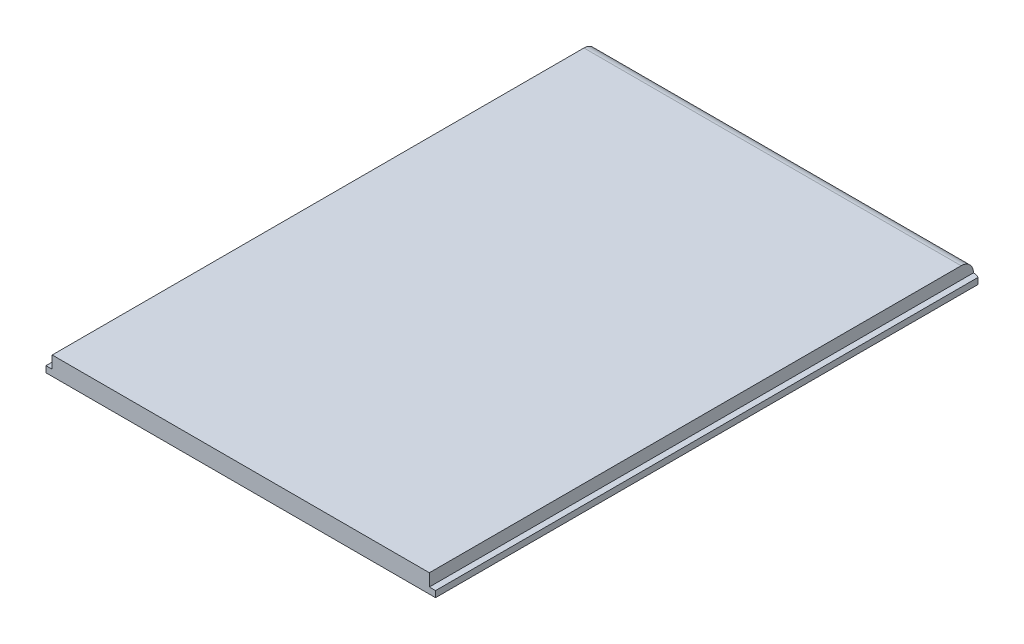
from build123d import *

# Parameters (mm, degrees)
SKETCH2_W           = 77.47
SKETCH2_H           = 111.76
BOSS_EXTRUDE1_DEPTH = 3.81
SKETCH3_W           = 1.27
SKETCH3_H           = 1.27
BOSS_EXTRUDE2_DEPTH = 111.76
FILLET1_R           = 2.54
CUT_EXTRUDE1_REACH  = 70.829


with BuildPart() as part:
    # Sketch2 → Boss-Extrude1 (new body)
    with BuildSketch(Plane(origin=(0, 0, 0), x_dir=(1, 0, 0), z_dir=(0, 1, 0))):
        Rectangle(SKETCH2_W, SKETCH2_H)
    extrude(amount=BOSS_EXTRUDE1_DEPTH)

    # Sketch3 → Boss-Extrude2 (add)
    with BuildSketch(Plane.XY.offset(55.88)):
        with Locations((-39.37, 0.635)):
            Rectangle(SKETCH3_W, SKETCH3_H)
        with Locations((39.37, 0.635)):
            Rectangle(SKETCH3_W, SKETCH3_H)
    extrude(amount=-BOSS_EXTRUDE2_DEPTH)

    # Fillet1
    fillet1_edges = [part.edges().sort_by_distance(p)[0] for p in [
        (0, 3.81, -55.88),
    ]]
    fillet(fillet1_edges, radius=FILLET1_R)

    # Sketch5 → Cut-Extrude1 (cut, up to next)
    with BuildSketch(Plane(origin=(0, 3.81, 0), x_dir=(1, 0, 0), z_dir=(0, 1, 0)), mode=Mode.PRIVATE) as cut_extrude1_sk1:
        with BuildLine():
            Line((40.005, 55.539704526), (40.005, 55.88))
            Line((40.005, 55.88), (38.735, 55.88))
            ThreePointArc((38.735, 55.88), (39.392400375, 55.793451599), (40.005, 55.539704526))
        make_face()
    cut_extrude1_tool1 = extrude(cut_extrude1_sk1.sketch, amount=-CUT_EXTRUDE1_REACH, mode=Mode.PRIVATE) & part.part
    # Sketch5 → Cut-Extrude1 (cut, up to next)
    with BuildSketch(Plane(origin=(0, 3.81, 0), x_dir=(1, 0, 0), z_dir=(0, 1, 0)), mode=Mode.PRIVATE) as cut_extrude1_sk2:
        with BuildLine():
            ThreePointArc((-40.005, 55.539704526), (-39.392400375, 55.793451599), (-38.735, 55.88))
            Line((-38.735, 55.88), (-40.005, 55.88))
            Line((-40.005, 55.88), (-40.005, 55.539704526))
        make_face()
    cut_extrude1_tool2 = extrude(cut_extrude1_sk2.sketch, amount=-CUT_EXTRUDE1_REACH, mode=Mode.PRIVATE) & part.part
    add(cut_extrude1_tool1.solids().sort_by_distance((39.69191, 3.81, -55.779201))[0], mode=Mode.SUBTRACT)
    add(cut_extrude1_tool2.solids().sort_by_distance((-39.69191, 3.81, -55.779201))[0], mode=Mode.SUBTRACT)


solid = part.part
